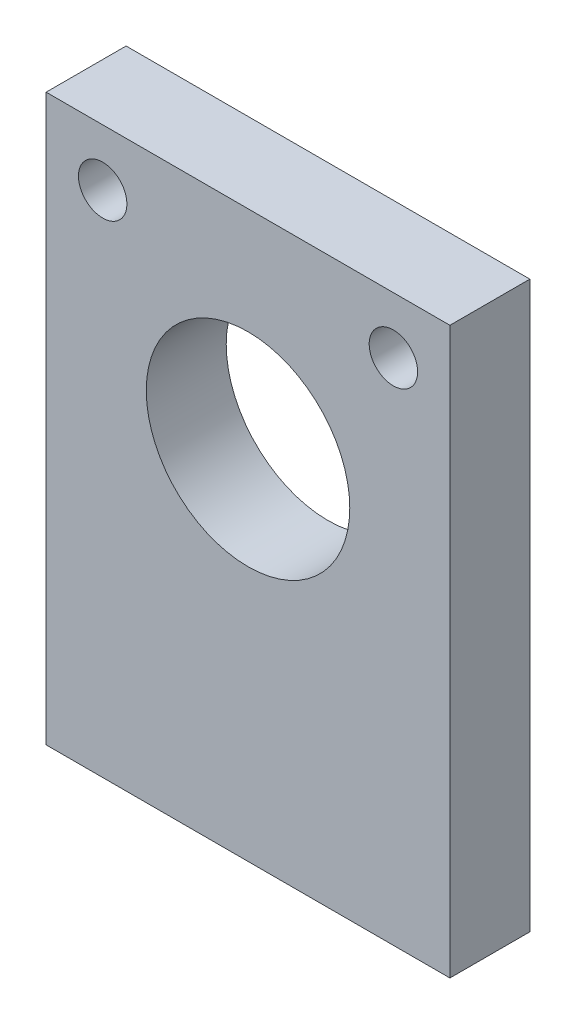
from build123d import *

# Parameters (mm, degrees)
CROQUIS1_W              = 50
CROQUIS1_H              = 70
CROQUIS1_R              = 3
SALIENTE_EXTRUIR1_DEPTH = 9.9
CROQUIS2_R              = 12.6
CORTAR_EXTRUIR1_DEPTH   = 9.9


with BuildPart() as part:
    # Croquis1 → Saliente-Extruir1 (new body)
    with BuildSketch(Plane.XY):
        Rectangle(CROQUIS1_W, CROQUIS1_H)
        with Locations(Location((-18, 28, 0), (0, 0, 180))):
            Circle(CROQUIS1_R, mode=Mode.SUBTRACT)
        with Locations(Location((18, 28, 0), (0, 0, 180))):
            Circle(CROQUIS1_R, mode=Mode.SUBTRACT)
    extrude(amount=SALIENTE_EXTRUIR1_DEPTH)

    # Croquis2 → Cortar-Extruir1 (cut)
    with BuildSketch(Plane.XY.offset(9.9)):
        with Locations((0, 9.20979846)):
            Circle(CROQUIS2_R)
    extrude(amount=-CORTAR_EXTRUIR1_DEPTH, mode=Mode.SUBTRACT)


solid = part.part
